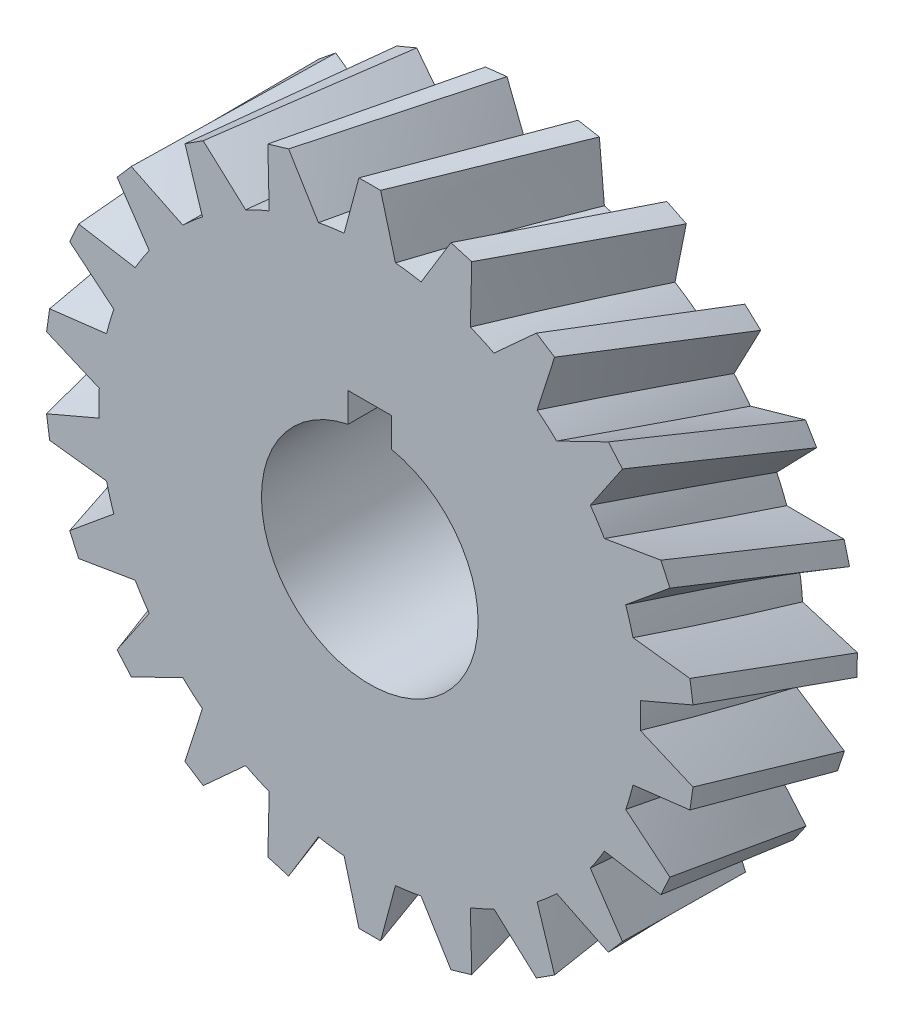
from build123d import *

# Parameters (mm, degrees)
SKETCH1_R           = 12.7
BOSS_EXTRUDE1_DEPTH = 7.62
CIRPATTERN1_COUNT   = 22
SKETCH4_R           = 5.08
CUT_EXTRUDE1_DEPTH  = 23.865631097
SKETCH5_W           = 2.032
SKETCH5_H           = 2.54
CUT_EXTRUDE2_DEPTH  = 23.865631097


with BuildPart() as part:
    # Sketch1 → Boss-Extrude1 (new body)
    with BuildSketch(Plane.XY):
        with Locations(Location((0, 0, 0), (0, 0, 180))):
            Circle(SKETCH1_R)
    extrude(amount=BOSS_EXTRUDE1_DEPTH)

    # Sketch2 → Loft1 section 0
    with BuildSketch(Plane.XY.offset(7.62)):
        with BuildLine():
            Line((-1.324709139, 12.192), (1.324709139, 12.192))
            Line((1.324709139, 12.192), (0.508, 15.24))
            Line((0.508, 15.24), (-0.508, 15.24))
            Line((-0.508, 15.24), (-1.324709139, 12.192))
        make_face()
    # Sketch3 → Loft1 section 1
    with BuildSketch(Plane(origin=(0, 0, 0), x_dir=(-1, 0, 0), z_dir=(0, 0, -1))):
        with BuildLine():
            Line((-3.421702412, 11.776742797), (-3.146680566, 14.920256882))
            Line((-3.146680566, 14.920256882), (-2.146115889, 15.09668343))
            Line((-2.146115889, 15.09668343), (-0.812534752, 12.236809453))
            Line((-0.812534752, 12.236809453), (-3.421702412, 11.776742797))
        make_face()
    loft1 = loft()

    # CirPattern1: Loft1 ×22 about axis
    cirpattern1_axis = Axis((0, 0, 7.62), (0, 0, -1))
    for i in range(1, CIRPATTERN1_COUNT):
        add(loft1.rotate(cirpattern1_axis, i * 360 / CIRPATTERN1_COUNT))

    # Sketch4 → Cut-Extrude1 (cut, through all)
    with BuildSketch(Plane(origin=(0, 0, 0), x_dir=(-1, 0, 0), z_dir=(0, 0, -1))):
        Circle(SKETCH4_R)
    extrude(amount=-CUT_EXTRUDE1_DEPTH, mode=Mode.SUBTRACT)

    # Sketch5 → Cut-Extrude2 (cut, through all)
    with BuildSketch(Plane(origin=(0, 0, 0), x_dir=(-1, 0, 0), z_dir=(0, 0, -1))):
        with Locations((0, 5.08)):
            Rectangle(SKETCH5_W, SKETCH5_H)
    extrude(amount=-CUT_EXTRUDE2_DEPTH, mode=Mode.SUBTRACT)


solid = part.part
